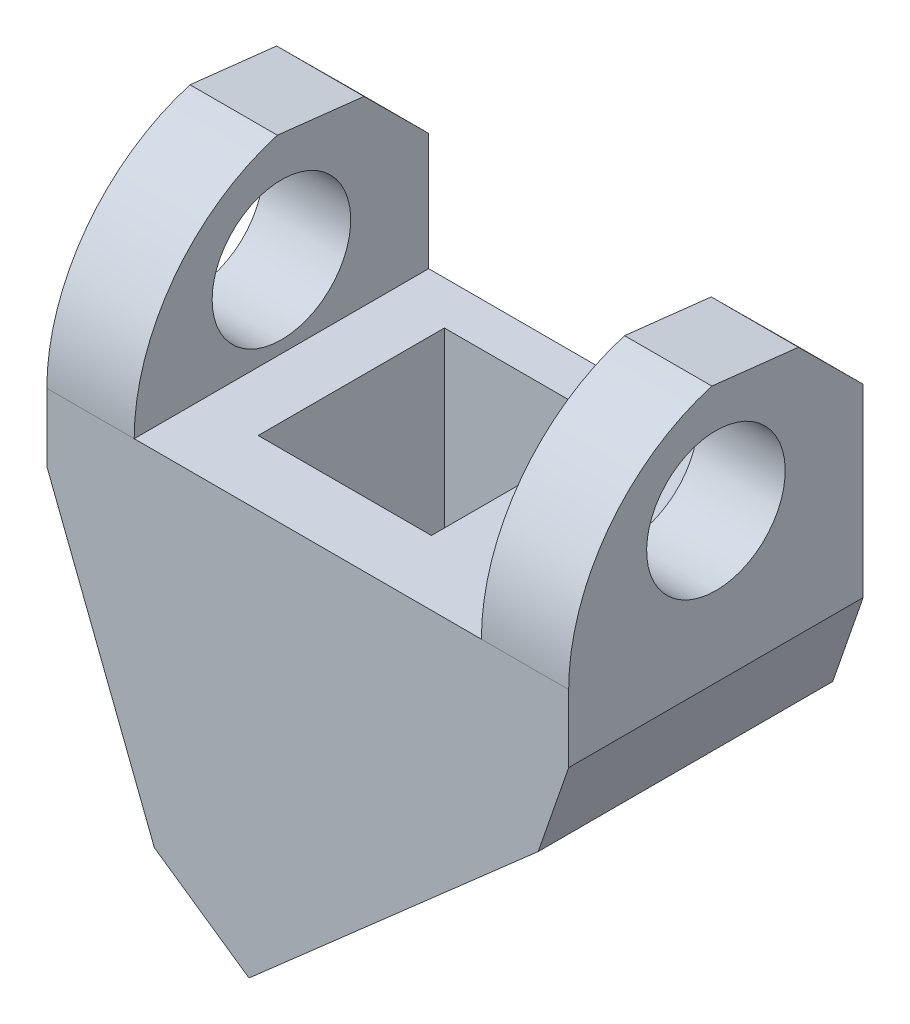
from build123d import *

# Parameters (mm, degrees)
BOSS_EXTRUDE1_DEPTH     = 17
CUT_EXTRUDE1_DEPTH      = 44
CUT_EXTRUDE1_DEPTH_BACK = 15
SKETCH3_W               = 9.473572921
SKETCH3_H               = 10.746142417
CUT_EXTRUDE4_REACH      = 44.203
SKETCH5_W               = 10
SKETCH5_H               = 10.75
CUT_EXTRUDE5_DEPTH      = 104.330721103
CUT_EXTRUDE5_DEPTH_BACK = 104.330721103
SKETCH6_R               = 4


with BuildPart() as part:
    # Sketch1 → Boss-Extrude1 (new body)
    with BuildSketch(Plane.XY):
        Polygon((-30.543999746, 100.861422718), (-25.501974605, 100.861422718), (-25.501974605, 89.763425291), (-5.459450623, 89.763425291), (-5.459450623, 100.861422718), (-0.421139822, 100.861422718), (-0.421139822, 85.861422718), (-2.179573068, 80.78462442), (-18.874125124, 66.117800283), (-24.336952566, 69.899502921), (-30.543999746, 85.861422718), align=None)
    extrude(amount=BOSS_EXTRUDE1_DEPTH)

    # Sketch2 → Cut-Extrude1 (cut, two sides: drawn at the far end of the back side and taken through both)
    with BuildSketch(Plane(origin=(-25.501974605, 0, 0), x_dir=(0, 0, -1), z_dir=(1, 0, 0)).offset(-CUT_EXTRUDE1_DEPTH_BACK)):
        with BuildLine():
            Line((-17, 100.861422718), (-17, 89.763425291))
            ThreePointArc((-17, 89.763425291), (-14.704510799, 96.659236925), (-8.73400026, 100.803448872))
            Line((-8.73400026, 100.803448872), (-3.73400026, 100.241430104))
            Line((-3.73400026, 100.241430104), (0, 96.527419984))
            Line((0, 96.527419984), (0, 100.861422718))
            Line((0, 100.861422718), (-17, 100.861422718))
        make_face()
    extrude(amount=CUT_EXTRUDE1_DEPTH + CUT_EXTRUDE1_DEPTH_BACK, mode=Mode.SUBTRACT)

    # Cut-Sweep1: sweep along a path in Sketch4
    with BuildLine(Plane.XY.offset(10)) as cut_sweep1_path:
        Line((-14.80649526, 69.691373965), (-22.116585307, 75.218908697))
    # Sketch3 → Cut-Sweep1 (sweep, cut)
    with BuildSketch(Plane(origin=(-41.005446227, 46.67455955, 0), x_dir=(0.7512573997247136, 0.6600093327816372, 0), z_dir=(0.6600093327816372, -0.7512573997247136, 0))):
        with Locations((38.216319794, 7.888020567)):
            Rectangle(SKETCH3_W, SKETCH3_H)
    sweep(path=cut_sweep1_path.line, mode=Mode.SUBTRACT)

    # Cut-Extrude4: up to this plane
    cut_extrude4_end = Plane(origin=(-15.039315265, 68.155566563, 13.261091776), z_dir=(0.6031355918435234, 0.7976386762510722, 0))
    # Sketch5 → Cut-Extrude4 (cut, up to the surface)
    with BuildSketch(Plane(origin=(0, 89.763425291, 0), x_dir=(1, 0, 0), z_dir=(0, 1, 0)), mode=Mode.PRIVATE) as cut_extrude4_sk1:
        with Locations((-17.083999746, -7.885)):
            Rectangle(SKETCH5_W, SKETCH5_H)
    cut_extrude4_tool1 = split(extrude(cut_extrude4_sk1.sketch, amount=-CUT_EXTRUDE4_REACH, mode=Mode.PRIVATE), bisect_by=cut_extrude4_end, keep=Keep.BOTH, mode=Mode.PRIVATE)
    add(cut_extrude4_tool1.solids().sort_by_distance((-17.084, 89.763425, 7.885))[0], mode=Mode.SUBTRACT)

    # Sketch6 → Cut-Extrude5 (cut, two sides: drawn at the far end of the back side and taken through both)
    with BuildSketch(Plane.ZY.offset(15.480712614).offset(-CUT_EXTRUDE5_DEPTH_BACK)):
        with Locations(Location((8.5, 94.459280843, 0), (0, 0, 270))):
            Circle(SKETCH6_R)
    extrude(amount=CUT_EXTRUDE5_DEPTH + CUT_EXTRUDE5_DEPTH_BACK, mode=Mode.SUBTRACT)


solid = part.part
